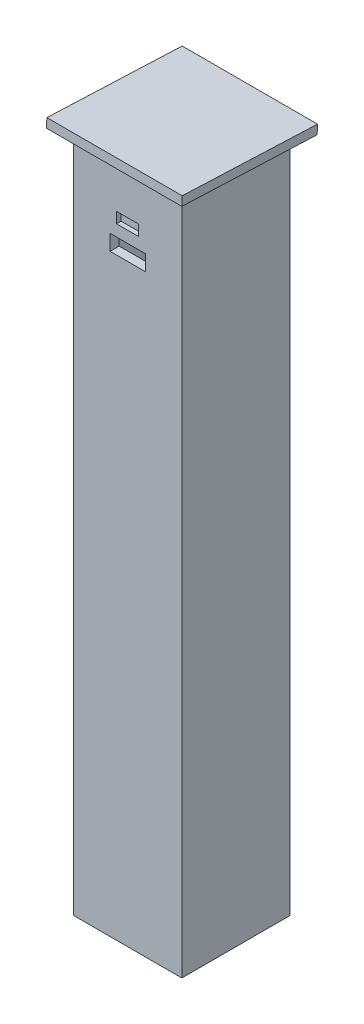
from build123d import *

# Parameters (mm, degrees)
SKETCH_1_W          = 240
SKETCH_1_H          = 240
SKETCH_1_W_2        = 200
SKETCH_1_H_2        = 200
EXTRUDE_1_DEPTH     = 1500
SKETCH_2_W          = 78
SKETCH_2_H          = 34.5
CUT_EXTRUDE_1_DEPTH = 20
EXTRUDE_2_DEPTH     = 240
SKETCH_4_W          = 300
SKETCH_4_H          = 300.208242989
EXTRUDE_3_DEPTH     = 20
SKETCH_6_W          = 49
SKETCH_6_H          = 24
CUT_EXTRUDE_3_DEPTH = 10


with BuildPart() as part:
    # Эскиз1 → Бобышка-Вытянуть1 (new body)
    with BuildSketch(Plane(origin=(0, 0, 0), x_dir=(1, 0, 0), z_dir=(0, 1, 0))):
        with Locations((-163.322789272, 28.35162174)):
            Rectangle(SKETCH_1_W, SKETCH_1_H)
        with Locations((-163.322789272, 28.35162174)):
            Rectangle(SKETCH_1_W_2, SKETCH_1_H_2, mode=Mode.SUBTRACT)
    extrude(amount=EXTRUDE_1_DEPTH)

    # Эскиз2 → Вырез-Вытянуть1 (cut)
    with BuildSketch(Plane.XY.offset(91.64837826)):
        with Locations((-163.322789272, 1332.75)):
            Rectangle(SKETCH_2_W, SKETCH_2_H)
    extrude(amount=-CUT_EXTRUDE_1_DEPTH, mode=Mode.SUBTRACT)

    # Эскиз3 → Бобышка-Вытянуть2 (add)
    with BuildSketch(Plane.ZY.offset(283.322789272)):
        Polygon((-148.35162174, 1500), (91.64837826, 1500), (91.64837826, 1510), align=None)
    extrude(amount=-EXTRUDE_2_DEPTH)

    # Эскиз4 → Бобышка-Вытянуть3 (add)
    with BuildSketch(Plane(origin=(0, 1503.570951338, -62.648789639), x_dir=(1, 0, 0), z_dir=(0, 0.999133073092352, -0.041630544712181396))):
        with Locations((-163.322789272, -34.326926836)):
            Rectangle(SKETCH_4_W, SKETCH_4_H)
    extrude(amount=EXTRUDE_3_DEPTH)

    # Эскиз6 → Вырез-Вытянуть3 (cut)
    with BuildSketch(Plane.XY.offset(91.64837826)):
        with Locations((-163.322789272, 1387.5)):
            Rectangle(SKETCH_6_W, SKETCH_6_H)
    extrude(amount=-CUT_EXTRUDE_3_DEPTH, mode=Mode.SUBTRACT)


solid = part.part
